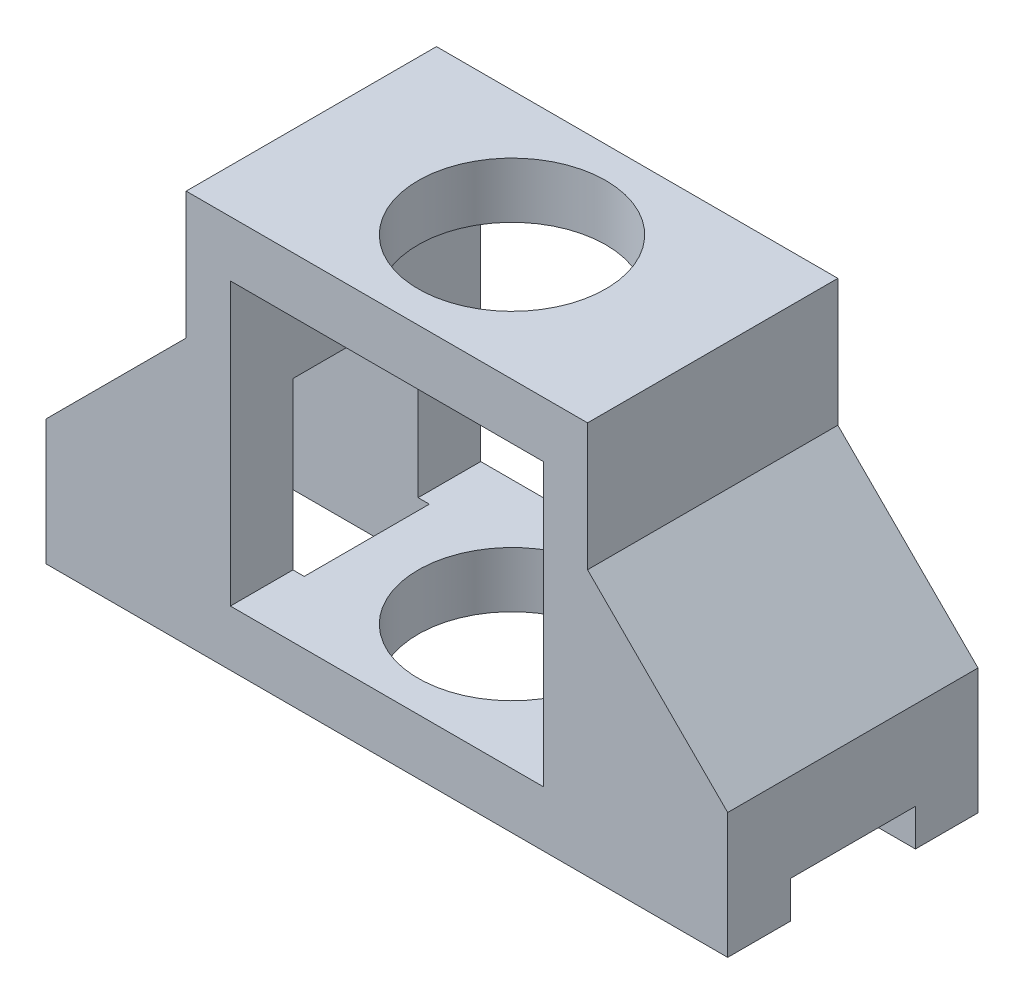
from build123d import *

# Parameters (mm, degrees)
SKETCH2_R           = 19.05
BOSS_EXTRUDE1_DEPTH = 152.4
BOSS_EXTRUDE2_DEPTH = 12.7
SKETCH4_W           = 138.346275672
SKETCH4_H           = 79.731841005
BOSS_EXTRUDE3_DEPTH = 50.8
SKETCH5_W           = 63.5
SKETCH5_H           = 57.15
CUT_EXTRUDE1_DEPTH  = 132.116075905
CUT_EXTRUDE2_DEPTH  = 132.116075905


with BuildPart() as part:
    # Sketch2 → Boss-Extrude1 (new body)
    with BuildSketch(Plane(origin=(0, 0, 0), x_dir=(1, 0, 0), z_dir=(0, 1, 0))):
        Circle(SKETCH2_R)
    extrude(amount=BOSS_EXTRUDE1_DEPTH)

    # Sketch3 → Boss-Extrude2 (add, symmetric)
    with BuildSketch(Plane.XY):
        Polygon((11.93183673, 72.08792673), (-6.028675512, 90.048438972), (-427.750314484, -331.6732), (-391.82929, -331.6732), align=None)
    boss_extrude2 = extrude(amount=BOSS_EXTRUDE2_DEPTH, both=True)

    # Mirror1: Boss-Extrude2 across plane
    add(boss_extrude2.mirror(Plane(origin=(0, 0, 0), x_dir=(0, 0, 1), z_dir=(1, 0, 0))))


with BuildPart() as body_2:
    # Sketch4 → Boss-Extrude3 (new body)
    with BuildSketch(Plane.XY.offset(25.4)):
        with Locations((0, 59.259567455)):
            Rectangle(SKETCH4_W, SKETCH4_H)
    extrude(amount=-BOSS_EXTRUDE3_DEPTH)

    # Combine1: cut part
    add(part.part, mode=Mode.SUBTRACT)

    # Sketch5 → Cut-Extrude1 (cut, through all)
    with BuildSketch(Plane.XY.offset(25.4)):
        with Locations((0, 59.259567454)):
            Rectangle(SKETCH5_W, SKETCH5_H)
    extrude(amount=-CUT_EXTRUDE1_DEPTH, mode=Mode.SUBTRACT)

    # Sketch6 → Cut-Extrude2 (cut, through all)
    with BuildSketch(Plane.XY.offset(25.4)):
        Polygon((-69.173137836, 99.125487957), (-69.173137836, 44.864488891), (-40.730256121, 73.307370605), (-40.730256121, 99.125487957), align=None)
    cut_extrude2 = extrude(amount=-CUT_EXTRUDE2_DEPTH, mode=Mode.SUBTRACT)

    # Mirror2: Cut-Extrude2 across plane
    add(cut_extrude2.mirror(Plane(origin=(0, 0, 0), x_dir=(0, 0, 1), z_dir=(1, 0, 0))), mode=Mode.SUBTRACT)


solid = body_2.part
